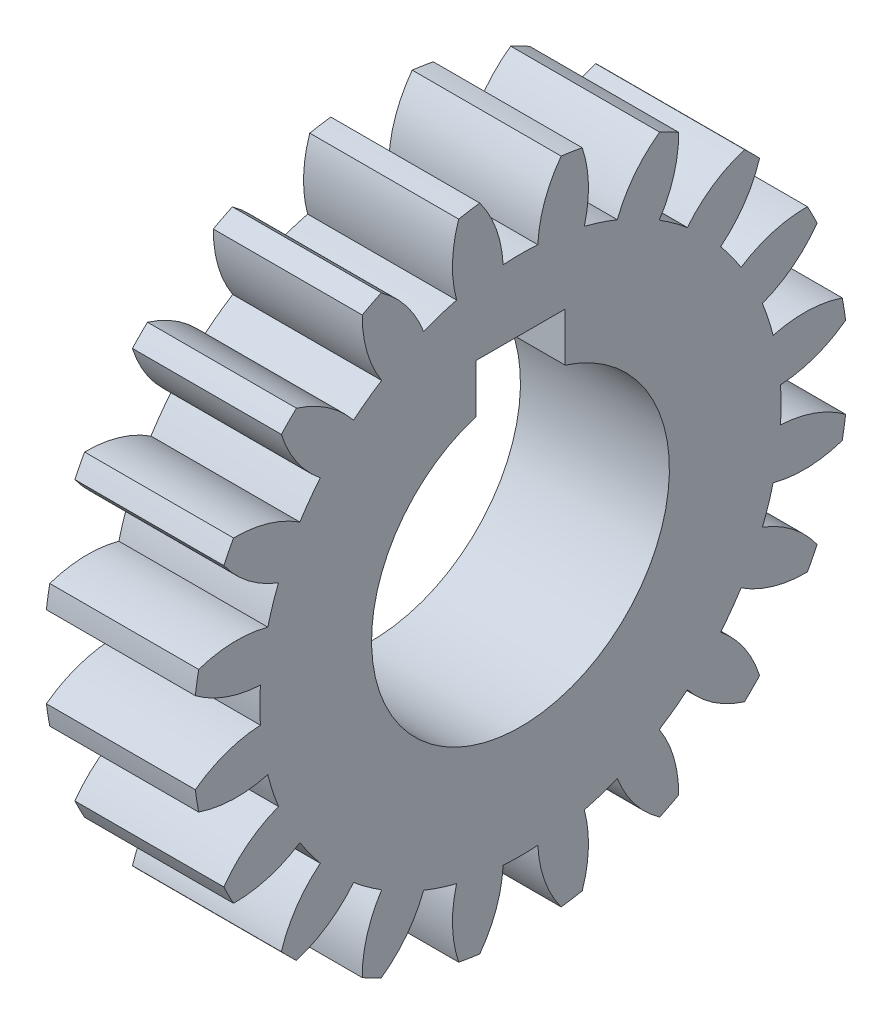
from build123d import *

# Parameters (mm, degrees)
BASPROSKE_W     = 10
BASPROSKE_H     = 22
TOOTHCUT_DEPTH  = 33.680269277
TEETHCUTS_COUNT = 20
TEETHCUTS_ANGLE = 342
BORSKE_R        = 10
BORE_DEPTH      = 50.0000508
KEYSKE_W        = 6
KEYSKE_H        = 12.8
KEYWAY_DEPTH    = 50.0000508


with BuildPart() as part:
    # BasProSke → Base-Revolve (revolve)
    with BuildSketch(Plane(origin=(0, 0, 0), x_dir=(1, 0, 0), z_dir=(0, 1, 0)), mode=Mode.PRIVATE) as base_revolve_sk:
        with Locations((5, 11)):
            Rectangle(BASPROSKE_W, BASPROSKE_H)
    revolve(base_revolve_sk.sketch.rotate(Axis((-10, 0, 0), (1, 0, 0)), 180), axis=Axis((-10, 0, 0), (1, 0, 0)))

    # TooCutSke → ToothCut (cut, through all)
    with BuildSketch(Plane(origin=(0, 0, 0), x_dir=(0, 0, -1), z_dir=(1, 0, 0))):
        with BuildLine():
            ThreePointArc((1.164972225, 17.460178714), (0, 17.499), (-1.164972225, 17.460178714))
            ThreePointArc((-1.164972225, 17.460178714), (-1.629088534, 19.774822006), (-2.748549048, 21.853231415))
            ThreePointArc((-2.748549048, 21.853231415), (0, 22.0254), (2.748549048, 21.853231415))
            ThreePointArc((2.748549048, 21.853231415), (1.629088534, 19.774822006), (1.164972225, 17.460178714))
        make_face()
    toothcut = extrude(amount=TOOTHCUT_DEPTH, mode=Mode.SUBTRACT)

    # TeethCuts: ToothCut ×20 about axis
    teethcuts_axis = Axis((-10, 0, 0), (1, 0, 0))
    for i in range(1, TEETHCUTS_COUNT):
        add(toothcut.rotate(teethcuts_axis, i * TEETHCUTS_ANGLE / (TEETHCUTS_COUNT - 1)), mode=Mode.SUBTRACT)

    # BorSke → Bore (cut, symmetric)
    with BuildSketch(Plane(origin=(0, 0, 0), x_dir=(0, 0, -1), z_dir=(1, 0, 0))):
        with Locations(Location((0, 0, 0), (0, 0, 180))):
            Circle(BORSKE_R)
    extrude(amount=BORE_DEPTH, both=True, mode=Mode.SUBTRACT)

    # KeySke → Keyway (cut, symmetric)
    with BuildSketch(Plane(origin=(0, 0, 0), x_dir=(0, 0, -1), z_dir=(1, 0, 0))):
        with Locations((0, 6.4)):
            Rectangle(KEYSKE_W, KEYSKE_H)
    extrude(amount=KEYWAY_DEPTH, both=True, mode=Mode.SUBTRACT)


solid = part.part
